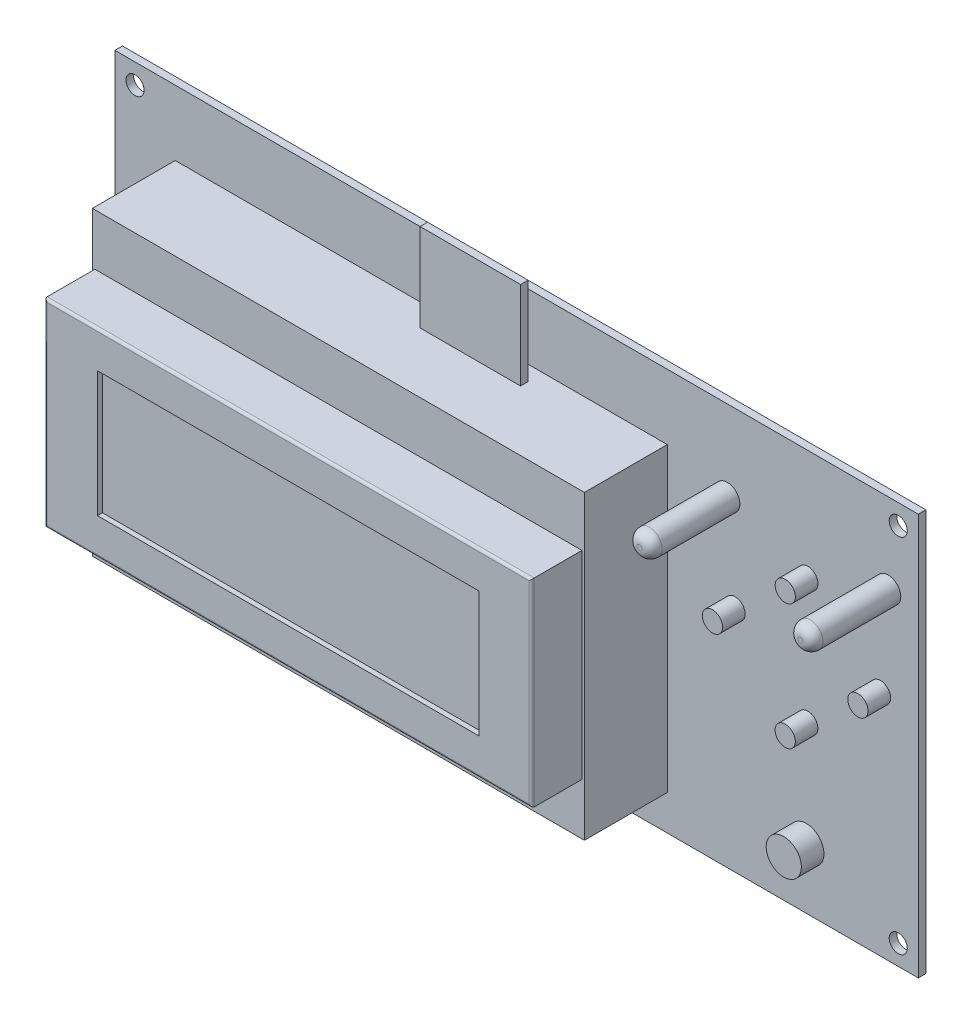
from build123d import *

# Parameters (mm, degrees)
MODEL_W                     = 160
MODEL_H                     = 80
MODEL_R                     = 2.55
MODEL_R_2                   = 1.8
MODEL_R_3                   = 2.5
MODEL_R_4                   = 3.5
MODEL_R_5                   = 2.015564
DODANIE_WYCI_GNI_CIE1_DEPTH = 1.5
MODEL_3_R                   = 2.015564
MODEL_3_R_2                 = 3.5
DODANIE_WYCI_GNI_CIE2_DEPTH = 6
MODEL_4_R                   = 2.5
DODANIE_WYCI_GNI_CIE3_DEPTH = 19
ZAOKR_GLENIE1_R             = 2
MODEL_5_W                   = 98
MODEL_5_H                   = 60
DODANIE_WYCI_GNI_CIE4_DEPTH = 18
MODEL_6_W                   = 97
MODEL_6_H                   = 39.5
DODANIE_WYCI_GNI_CIE5_DEPTH = 28
SZKIC2_W                    = 76
SZKIC2_H                    = 25
WYTNIJ_WYCI_GNI_CIE1_DEPTH  = 1
ZAOKR_GLENIE2_R             = 0.5
DODANIE_WYCI_GNI_CIE6_START = 3
SZKIC3_W                    = 20
SZKIC3_H                    = 33.5
DODANIE_WYCI_GNI_CIE6_DEPTH = 1.5


with BuildPart() as part:
    # Model → Dodanie-wyciągnięcie1 (new body)
    with BuildSketch(Plane.XY):
        with Locations((80, 40)):
            Rectangle(MODEL_W, MODEL_H)
        with Locations((14.5, 64.5)):
            Circle(MODEL_R, mode=Mode.SUBTRACT)
        with Locations((4, 4)):
            Circle(MODEL_R_2, mode=Mode.SUBTRACT)
        with Locations((154.00374, 64.012896)):
            Circle(MODEL_R_3, mode=Mode.SUBTRACT)
        with Locations((14.5, 9.5)):
            Circle(MODEL_R, mode=Mode.SUBTRACT)
        with Locations((107.5, 9.5)):
            Circle(MODEL_R, mode=Mode.SUBTRACT)
        with Locations((107.5, 64.5)):
            Circle(MODEL_R, mode=Mode.SUBTRACT)
        with Locations((156, 76)):
            Circle(MODEL_R_2, mode=Mode.SUBTRACT)
        with Locations((156, 4)):
            Circle(MODEL_R_2, mode=Mode.SUBTRACT)
        with Locations((137.7008, 12)):
            Circle(MODEL_R_4, mode=Mode.SUBTRACT)
        with Locations((137.989674, 33.022353)):
            Circle(MODEL_R_5, mode=Mode.SUBTRACT)
        with Locations((4, 76)):
            Circle(MODEL_R_2, mode=Mode.SUBTRACT)
        with Locations((123.499421, 45.511083)):
            Circle(MODEL_R_5, mode=Mode.SUBTRACT)
        with Locations((152.465613, 45.526919)):
            Circle(MODEL_R_5, mode=Mode.SUBTRACT)
        with Locations((138, 58)):
            Circle(MODEL_R_5, mode=Mode.SUBTRACT)
        with Locations((121.957824, 63.96421)):
            Circle(MODEL_R_3, mode=Mode.SUBTRACT)
        Polygon((109.5, 56.75), (109.5, 17.25), (12.5, 17.25), (12.5, 56.75), (70.19, 56.75), (70.19, 57.27), (79.715, 57.27), (80.235, 56.75), align=None, mode=Mode.SUBTRACT)
    extrude(amount=DODANIE_WYCI_GNI_CIE1_DEPTH)

    # Model<3> → Dodanie-wyciągnięcie2 (add)
    with BuildSketch(Plane.XY):
        with Locations((152.465613, 45.526919)):
            Circle(MODEL_3_R)
        with Locations((138, 58)):
            Circle(MODEL_3_R)
        with Locations((137.7008, 12)):
            Circle(MODEL_3_R_2)
        with Locations((137.989674, 33.022353)):
            Circle(MODEL_3_R)
        with Locations((123.499421, 45.511083)):
            Circle(MODEL_3_R)
    extrude(amount=DODANIE_WYCI_GNI_CIE2_DEPTH)

    # Model<4> → Dodanie-wyciągnięcie3 (add)
    with BuildSketch(Plane.XY):
        with Locations((154.00374, 64.012896)):
            Circle(MODEL_4_R)
        with Locations((121.957824, 63.96421)):
            Circle(MODEL_4_R)
    extrude(amount=DODANIE_WYCI_GNI_CIE3_DEPTH)

    # Zaokrąglenie1
    zaokr_glenie1_edges = [part.edges().sort_by_distance(p)[0] for p in [
        (151.50374, 64.012896, 19),
        (119.457824, 63.96421, 19),
    ]]
    fillet(zaokr_glenie1_edges, radius=ZAOKR_GLENIE1_R)

    # Model<5> → Dodanie-wyciągnięcie4 (add)
    with BuildSketch(Plane.XY):
        with Locations((61, 37)):
            Rectangle(MODEL_5_W, MODEL_5_H)
    extrude(amount=DODANIE_WYCI_GNI_CIE4_DEPTH)

    # Model<6> → Dodanie-wyciągnięcie5 (add)
    with BuildSketch(Plane.XY):
        with Locations((61, 37)):
            Rectangle(MODEL_6_W, MODEL_6_H)
    extrude(amount=DODANIE_WYCI_GNI_CIE5_DEPTH)

    # Szkic2 → Wytnij-wyciągnięcie1 (cut)
    with BuildSketch(Plane.XY.offset(28)):
        with Locations((61, 37)):
            Rectangle(SZKIC2_W, SZKIC2_H)
    extrude(amount=-WYTNIJ_WYCI_GNI_CIE1_DEPTH, mode=Mode.SUBTRACT)

    # Zaokrąglenie2
    zaokr_glenie2_edges = [part.edges().sort_by_distance(p)[0] for p in [
        (109.5, 37, 28),
        (61, 56.75, 28),
        (12.5, 37, 28),
        (61, 17.25, 28),
    ]]
    fillet(zaokr_glenie2_edges, radius=ZAOKR_GLENIE2_R)

    # Szkic3 → Dodanie-wyciągnięcie6 (add)
    with BuildSketch(Plane.XY.offset(1.5).offset(DODANIE_WYCI_GNI_CIE6_START)):
        with Locations((75.27, 67.75)):
            Rectangle(SZKIC3_W, SZKIC3_H)
    extrude(amount=DODANIE_WYCI_GNI_CIE6_DEPTH)


solid = part.part
